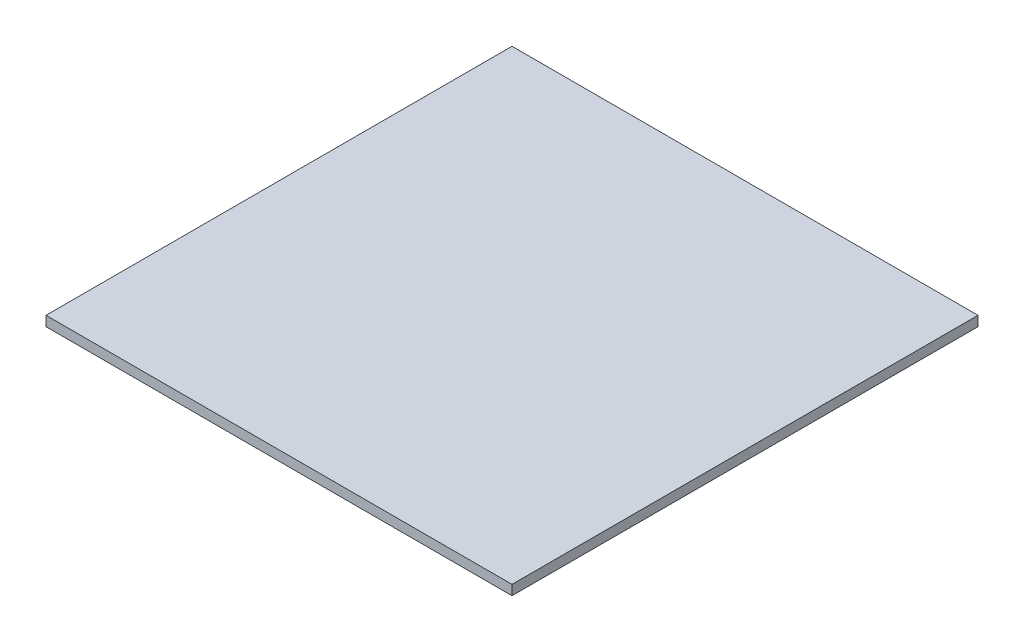
from build123d import *

# Parameters (mm, degrees)
SKETCH1_W           = 300
SKETCH1_H           = 300
BOSS_EXTRUDE1_DEPTH = 6.35


with BuildPart() as part:
    # Sketch1 → Boss-Extrude1 (new body)
    with BuildSketch(Plane(origin=(0, 0, 0), x_dir=(1, 0, 0), z_dir=(0, 1, 0))):
        Rectangle(SKETCH1_W, SKETCH1_H)
    extrude(amount=BOSS_EXTRUDE1_DEPTH)


solid = part.part
